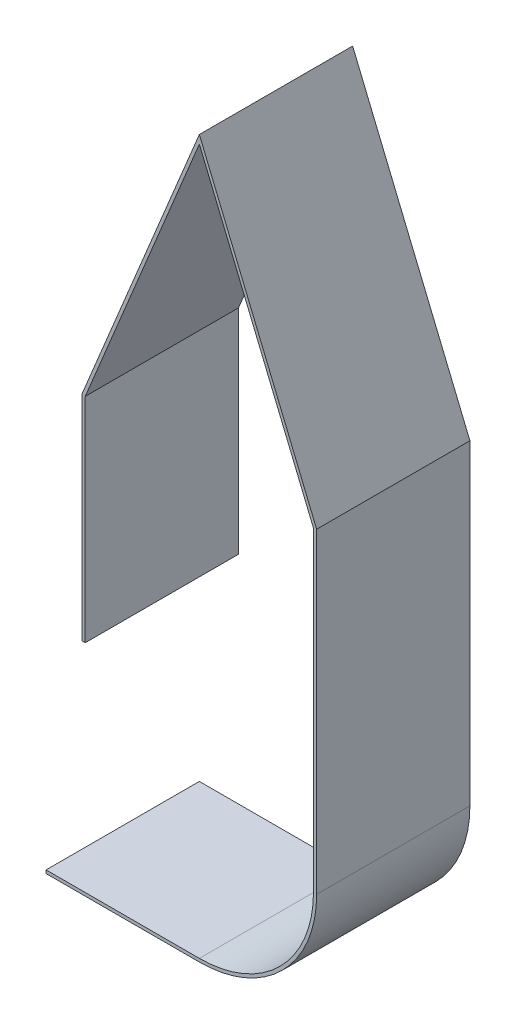
from build123d import *

# Parameters (mm, degrees)
BOSS_EXTRUDE1_DEPTH = 76.2


with BuildPart() as part:
    # Sketch2 → Boss-Extrude1 (new body)
    with BuildSketch(Plane.XY):
        with BuildLine():
            Line((0, 0), (58.320955092, -140.799240755))
            Line((58.320955092, -140.799240755), (58.320955092, -247.213806647))
            Line((58.320955092, -247.213806647), (58.320955092, -298.013806647))
            ThreePointArc((58.320955092, -298.013806647), (41.239142831, -339.252949479), (0, -356.33476174))
            Line((0, -356.33476174), (-76.2, -356.33476174))
            Line((-76.2, -356.33476174), (-76.2, -354.74726174))
            Line((-76.2, -354.74726174), (0, -354.74726174))
            ThreePointArc((0, -354.74726174), (40.116610816, -338.130417463), (56.733455092, -298.013806647))
            Line((56.733455092, -298.013806647), (56.733455092, -247.213806647))
            Line((56.733455092, -247.213806647), (56.733455092, -141.115014138))
            Line((56.733455092, -141.115014138), (0, -4.148337413))
            Line((0, -4.148337413), (-56.733455092, -141.115014138))
            Line((-56.733455092, -141.115014138), (-56.733455092, -247.213806647))
            Line((-56.733455092, -247.213806647), (-58.320955092, -247.213806647))
            Line((-58.320955092, -247.213806647), (-58.320955092, -140.799240755))
            Line((-58.320955092, -140.799240755), (0, 0))
        make_face()
    extrude(amount=-BOSS_EXTRUDE1_DEPTH)


solid = part.part
